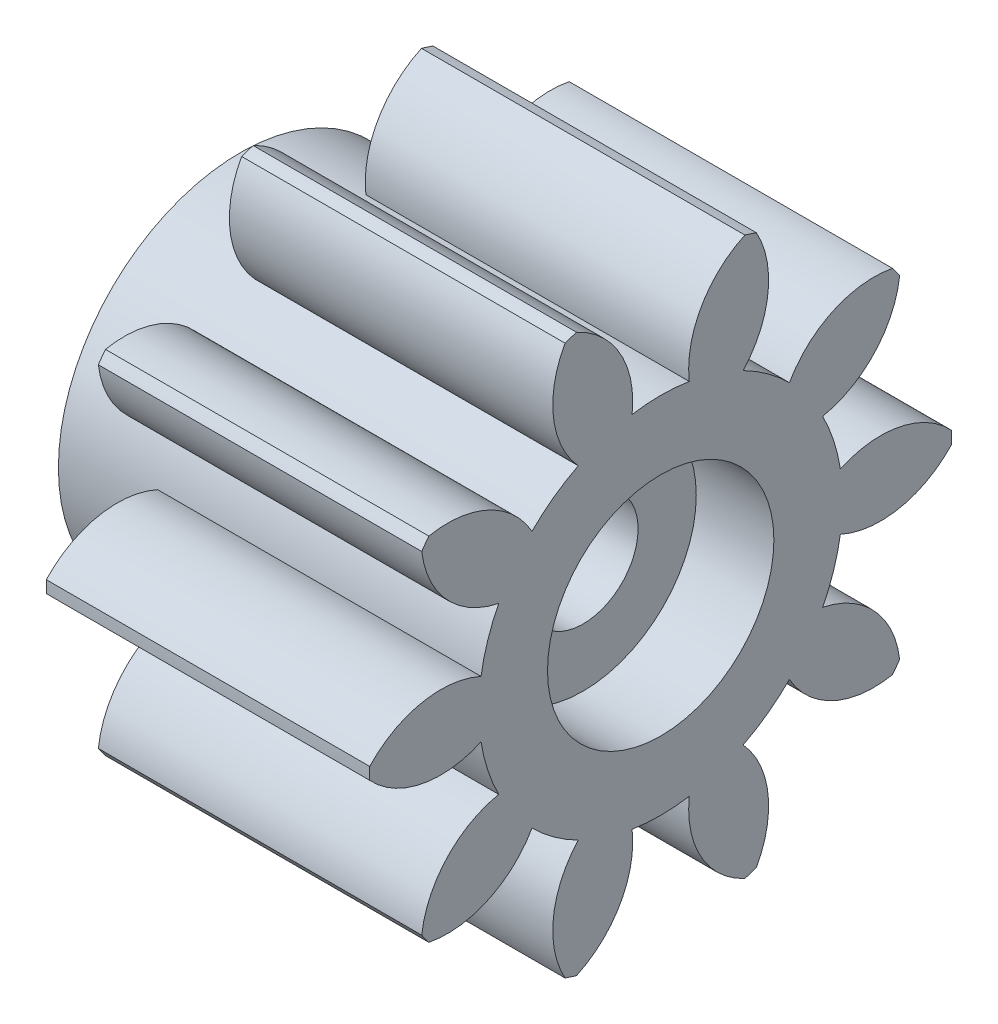
from build123d import *
from build123d.topology import SkipClean

# Parameters (mm, degrees)
BASPROSKE_W                                          = 10
BASPROSKE_H                                          = 9
TOOTHCUT_DEPTH                                       = 17.186414
TEETHCUTS_COUNT                                      = 10
SALIENTE_EXTRUIR2_START                              = 3
CROQUIS2_R                                           = 5.624
SALIENTE_EXTRUIR2_DEPTH                              = 3
REFRENTADO_PARA_TORNILLO_CON_CABEZA_TRON_D           = 3.4
REFRENTADO_PARA_TORNILLO_CON_CABEZA_TRON_CBORE_D     = 7
REFRENTADO_PARA_TORNILLO_CON_CABEZA_TRON_CBORE_DEPTH = 2.4
CROQUIS5_R                                           = 1
CORTAR_EXTRUIR1_DEPTH                                = 3


with BuildPart() as part:
    # BasProSke → Base-Revolve (revolve)
    with BuildSketch(Plane(origin=(0, 0, 0), x_dir=(1, 0, 0), z_dir=(0, 1, 0)), mode=Mode.PRIVATE) as base_revolve_sk:
        with Locations((5, 4.5)):
            Rectangle(BASPROSKE_W, BASPROSKE_H)
    revolve(base_revolve_sk.sketch.rotate(Axis((-10, 0, 0), (1, 0, 0)), 180), axis=Axis((-10, 0, 0), (1, 0, 0)))

    # TooCutSke → ToothCut (cut, through all)
    with BuildSketch(Plane(origin=(0, 0, 0), x_dir=(0, 0, -1), z_dir=(1, 0, 0))):
        with BuildLine():
            ThreePointArc((0.883878, 5.55411), (0, 5.624), (-0.883878, 5.55411))
            ThreePointArc((-0.883878, 5.55411), (-1.258246, 7.379188), (-2.637817, 8.631325))
            ThreePointArc((-2.637817, 8.631325), (0, 9.0254), (2.637817, 8.631325))
            ThreePointArc((2.637817, 8.631325), (1.258246, 7.379188), (0.883878, 5.55411))
        make_face()
    toothcut = extrude(amount=TOOTHCUT_DEPTH, mode=Mode.SUBTRACT)

    # TeethCuts: ToothCut ×10 about axis
    teethcuts_axis = Axis((0, 0, 0), (1, 0, 0))
    for i in range(1, TEETHCUTS_COUNT):
        add(toothcut.rotate(teethcuts_axis, i * 360 / TEETHCUTS_COUNT), mode=Mode.SUBTRACT)

    # Croquis2 → Saliente-Extruir2 (add)
    with SkipClean():  # the faces are left unmerged after this step: merging them gives an invalid solid
        with BuildSketch(Plane.ZY.offset(SALIENTE_EXTRUIR2_START)):
            Circle(CROQUIS2_R)
        extrude(amount=-SALIENTE_EXTRUIR2_DEPTH)

    # Refrentado para tornillo con cabeza troncocónica de M31 (through all)
    with Locations(Plane(origin=(10, 0, 0), x_dir=(0, 0, -1), z_dir=(1, 0, 0))):
        with Locations((0, 0)):
            CounterBoreHole(REFRENTADO_PARA_TORNILLO_CON_CABEZA_TRON_D / 2, REFRENTADO_PARA_TORNILLO_CON_CABEZA_TRON_CBORE_D / 2, REFRENTADO_PARA_TORNILLO_CON_CABEZA_TRON_CBORE_DEPTH)

    # Croquis5 → Cortar-Extruir1 (cut)
    with SkipClean():  # the faces are left unmerged after this step: merging them gives an invalid solid
        with BuildSketch(Plane.ZY.offset(3)):
            with Locations((0, 3.6)):
                Circle(CROQUIS5_R)
            with Locations((3.117691, -1.8)):
                Circle(CROQUIS5_R)
            with Locations((-3.117691, -1.8)):
                Circle(CROQUIS5_R)
        extrude(amount=-CORTAR_EXTRUIR1_DEPTH, mode=Mode.SUBTRACT)


solid = part.part
